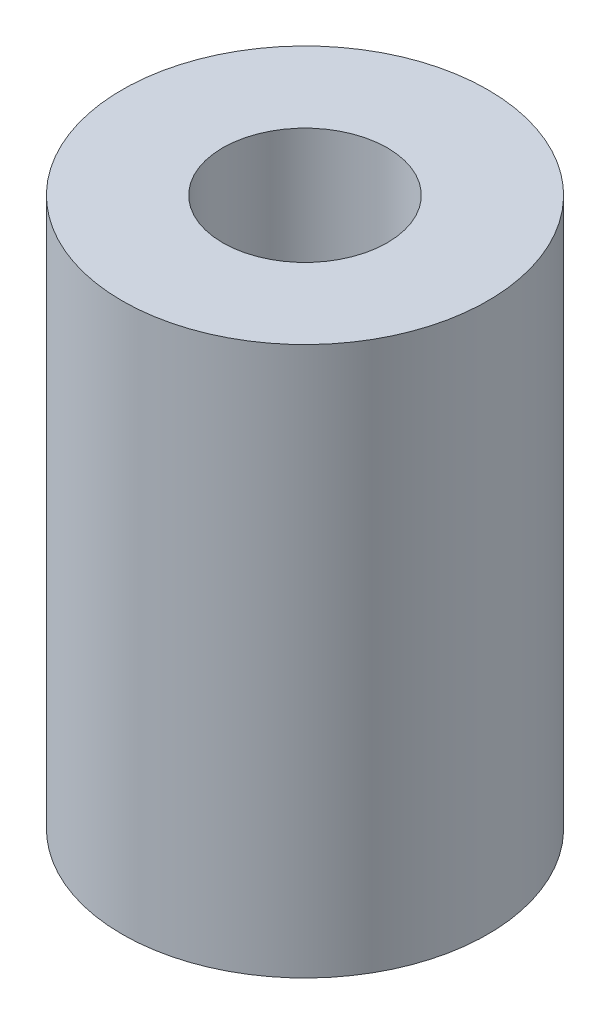
from build123d import *

# Parameters (mm, degrees)
SKETCH1_R           = 12.7
BOSS_EXTRUDE1_DEPTH = 38.1
SKETCH2_R           = 5.715
CUT_EXTRUDE1_DEPTH  = 43.121134838
SKETCH3_R           = 9.3345
CUT_EXTRUDE2_DEPTH  = 12.7


with BuildPart() as part:
    # Sketch1 → Boss-Extrude1 (new body)
    with BuildSketch(Plane(origin=(0, 0, 0), x_dir=(1, 0, 0), z_dir=(0, 1, 0))):
        with Locations(Location((0, 0, 0), (0, 0, 90))):
            Circle(SKETCH1_R)
    extrude(amount=BOSS_EXTRUDE1_DEPTH)

    # Sketch2 → Cut-Extrude1 (cut, through all)
    with BuildSketch(Plane(origin=(0, 38.1, 0), x_dir=(1, 0, 0), z_dir=(0, 1, 0))):
        with Locations(Location((0, 0, 0), (0, 0, 270))):
            Circle(SKETCH2_R)
    extrude(amount=-CUT_EXTRUDE1_DEPTH, mode=Mode.SUBTRACT)

    # Sketch3 → Cut-Extrude2 (cut)
    with BuildSketch(Plane.XZ):
        with Locations(Location((0, 0, 0), (0, 0, 270))):
            Circle(SKETCH3_R)
    extrude(amount=-CUT_EXTRUDE2_DEPTH, mode=Mode.SUBTRACT)


solid = part.part
